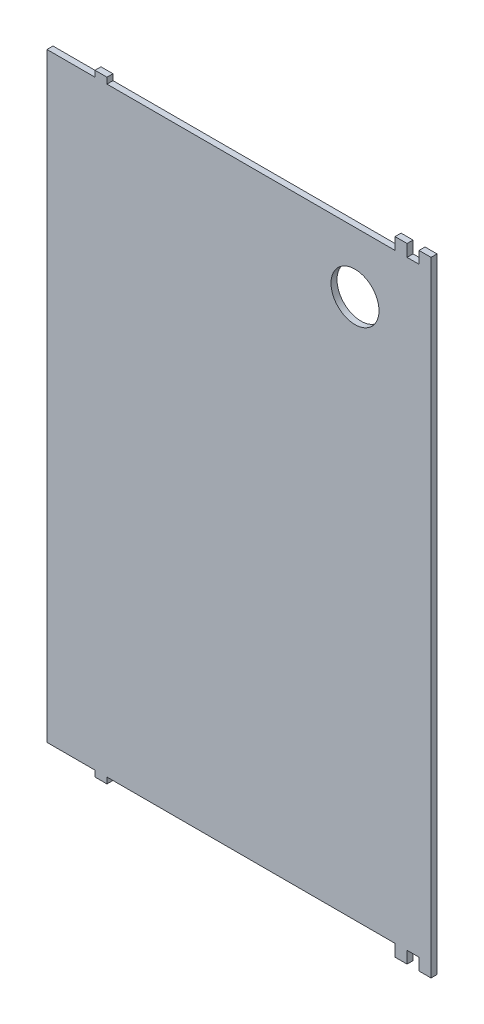
from build123d import *

# Parameters (mm, degrees)
SKETCH_1_R      = 8
EXTRUDE_1_DEPTH = 2


with BuildPart() as part:
    # 草图1 → 凸台-拉伸1 (new body)
    with BuildSketch(Plane.XY):
        Polygon((43.631358885, -53.10989547), (43.631358885, -57.10989547), (39.631358885, -57.10989547), (39.631358885, -53.10989547), (35.631358885, -53.10989547), (35.631358885, -57.10989547), (31.631358885, -57.10989547), (31.631358885, -53.10989547), (-64.368641115, -53.10989547), (-64.368641115, -55.10989547), (-66.368641115, -55.10989547), (-68.368641115, -55.10989547), (-68.368641115, -53.10989547), (-84.368641115, -53.10989547), (-84.368641115, 146.89010453), (-68.368641115, 146.89010453), (-68.368641115, 148.89010453), (-66.368641115, 148.89010453), (-64.368641115, 148.89010453), (-64.368641115, 146.89010453), (31.631358885, 146.89010453), (31.631358885, 150.89010453), (35.631358885, 150.89010453), (35.631358885, 146.89010453), (39.631358885, 146.89010453), (39.631358885, 150.89010453), (43.631358885, 150.89010453), (43.631358885, 146.89010453), align=None)
        with Locations((18.289168192, 126.803401032)):
            Circle(SKETCH_1_R, mode=Mode.SUBTRACT)
    extrude(amount=EXTRUDE_1_DEPTH)


solid = part.part
